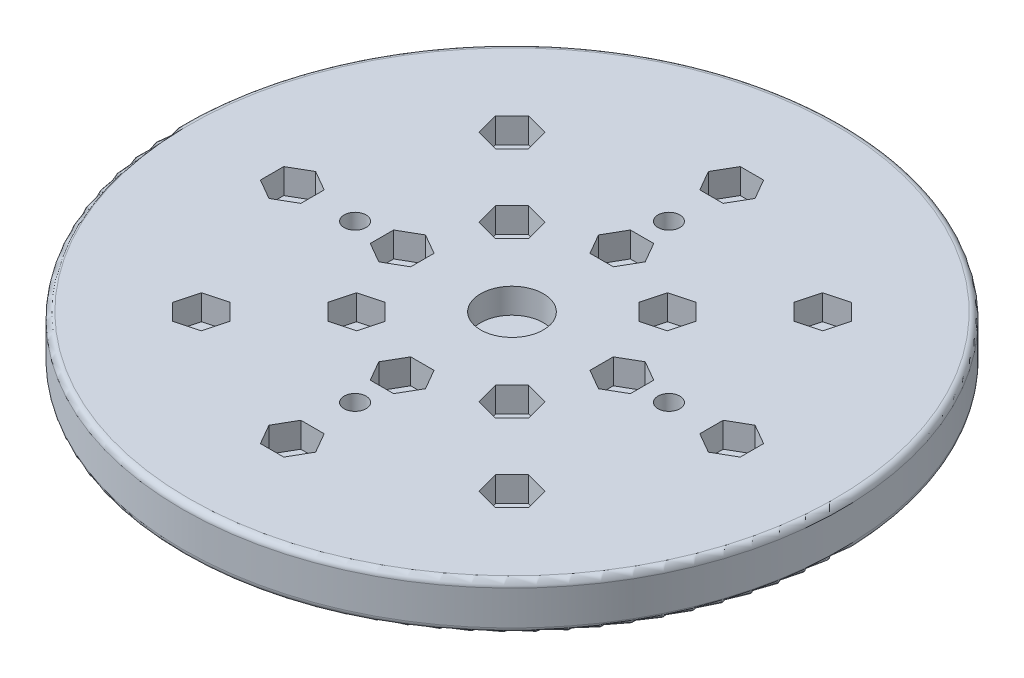
from build123d import *

# Parameters (mm, degrees)
SKETCH1_R                 = 105
BOSS_EXTRUDE1_DEPTH       = 7.5
SKETCH2_R                 = 3.5
CUT_EXTRUDE2_DEPTH        = 7.5
CIRPATTERN1_COUNT         = 2
CIRPATTERN1_ANGLE         = 90
FILLET2_R                 = 2
CUT_EXTRUDE3_DEPTH        = 8
LPATTERN1_COUNT           = 3
LPATTERN1_PITCH           = 35
CIRPATTERN2_COUNT         = 8
CIRPATTERN2_COPY_1_DEPTH  = 8
CIRPATTERN2_COPY_2_DEPTH  = 8
CIRPATTERN2_COPY_3_DEPTH  = 8
CIRPATTERN2_COPY_4_DEPTH  = 8
CIRPATTERN2_COPY_5_DEPTH  = 8
CIRPATTERN2_COPY_6_DEPTH  = 8
CIRPATTERN2_COPY_7_DEPTH  = 8
CIRPATTERN2_COPY_8_DEPTH  = 8
CIRPATTERN2_COPY_9_DEPTH  = 8
CIRPATTERN2_COPY_10_DEPTH = 8
CIRPATTERN2_COPY_11_DEPTH = 8
CIRPATTERN2_COPY_12_DEPTH = 8
CIRPATTERN2_COPY_13_DEPTH = 8
CIRPATTERN2_COPY_14_DEPTH = 8
SKETCH4_R                 = 10
CUT_EXTRUDE4_DEPTH        = 8


with BuildPart() as part:
    # Sketch1 → Boss-Extrude1 (new, symmetric)
    with BuildSketch(Plane(origin=(0, 0, 0), x_dir=(1, 0, 0), z_dir=(0, 1, 0))):
        with Locations(Location((0, 0, 0), (0, 0, 270))):
            Circle(SKETCH1_R)
    extrude(amount=BOSS_EXTRUDE1_DEPTH, both=True)

    # Sketch2 → Cut-Extrude2 (cut, symmetric)
    with BuildSketch(Plane(origin=(0, 0, 0), x_dir=(1, 0, 0), z_dir=(0, 1, 0))):
        with Locations(Location((0, 50, 0), (0, 0, 270))):
            Circle(SKETCH2_R)
        with Locations(Location((0, -50, 0), (0, 0, 270))):
            Circle(SKETCH2_R)
    cut_extrude2 = extrude(amount=CUT_EXTRUDE2_DEPTH, both=True, mode=Mode.SUBTRACT)

    # CirPattern1: Cut-Extrude2 ×2 about axis
    cirpattern1_axis = Axis((0, 0, 0), (0, 1, 0))
    for i in range(1, CIRPATTERN1_COUNT):
        add(cut_extrude2.rotate(cirpattern1_axis, i * CIRPATTERN1_ANGLE / (CIRPATTERN1_COUNT - 1)), mode=Mode.SUBTRACT)

    # Fillet2
    fillet2_edges = [part.edges().sort_by_distance(p)[0] for p in [
        (0, -7.5, -105),
        (0, 7.5, -105),
    ]]
    fillet(fillet2_edges, radius=FILLET2_R)

    # Sketch3 → Cut-Extrude3 (cut)
    with BuildSketch(Plane(origin=(0, 7.5, 0), x_dir=(1, 0, 0), z_dir=(0, 1, 0))):
        Polygon((3.718255526, 6.440207487), (-3.718255526, 6.440207487), (-7.436511052, 0), (-3.718255526, -6.440207487), (3.718255526, -6.440207487), (7.436511052, 0), align=None)
    cut_extrude3 = extrude(amount=-CUT_EXTRUDE3_DEPTH, mode=Mode.SUBTRACT)

    # LPattern1: Cut-Extrude3 ×3
    with Locations(*[(0, 0, i * LPATTERN1_PITCH) for i in range(1, LPATTERN1_COUNT)]):
        add(cut_extrude3, mode=Mode.SUBTRACT)

    # CirPattern2: Cut-Extrude3 ×8 about axis
    cirpattern2_axis = Axis((0, 0, 0), (0, 1, 0))
    for i in range(1, CIRPATTERN2_COUNT):
        add(cut_extrude3.rotate(cirpattern2_axis, i * 360 / CIRPATTERN2_COUNT), mode=Mode.SUBTRACT)

    # CirPattern2 copy 1 sketch → CirPattern2 copy 1 (cut)
    with BuildSketch(Plane(origin=(24.748737342, 7.5, 24.748737342), x_dir=(0.7071067811865476, 0, -0.7071067811865475), z_dir=(0, 1, 0))):
        Polygon((3.718255526, 6.440207487), (-3.718255526, 6.440207487), (-7.436511052, 0), (-3.718255526, -6.440207487), (3.718255526, -6.440207487), (7.436511052, 0), align=None)
    extrude(amount=-CIRPATTERN2_COPY_1_DEPTH, mode=Mode.SUBTRACT)

    # CirPattern2 copy 2 sketch → CirPattern2 copy 2 (cut)
    with BuildSketch(Plane(origin=(35, 7.5, 0), x_dir=(0, 0, -1), z_dir=(0, 1, 0))):
        Polygon((3.718255526, 6.440207487), (-3.718255526, 6.440207487), (-7.436511052, 0), (-3.718255526, -6.440207487), (3.718255526, -6.440207487), (7.436511052, 0), align=None)
    extrude(amount=-CIRPATTERN2_COPY_2_DEPTH, mode=Mode.SUBTRACT)

    # CirPattern2 copy 3 sketch → CirPattern2 copy 3 (cut)
    with BuildSketch(Plane(origin=(24.748737342, 7.5, -24.748737342), x_dir=(-0.7071067811865475, 0, -0.7071067811865476), z_dir=(0, 1, 0))):
        Polygon((3.718255526, 6.440207487), (-3.718255526, 6.440207487), (-7.436511052, 0), (-3.718255526, -6.440207487), (3.718255526, -6.440207487), (7.436511052, 0), align=None)
    extrude(amount=-CIRPATTERN2_COPY_3_DEPTH, mode=Mode.SUBTRACT)

    # CirPattern2 copy 4 sketch → CirPattern2 copy 4 (cut)
    with BuildSketch(Plane(origin=(0, 7.5, -35), x_dir=(-1, 0, 0), z_dir=(0, 1, 0))):
        Polygon((3.718255526, 6.440207487), (-3.718255526, 6.440207487), (-7.436511052, 0), (-3.718255526, -6.440207487), (3.718255526, -6.440207487), (7.436511052, 0), align=None)
    extrude(amount=-CIRPATTERN2_COPY_4_DEPTH, mode=Mode.SUBTRACT)

    # CirPattern2 copy 5 sketch → CirPattern2 copy 5 (cut)
    with BuildSketch(Plane(origin=(-24.748737342, 7.5, -24.748737342), x_dir=(-0.7071067811865477, 0, 0.7071067811865475), z_dir=(0, 1, 0))):
        Polygon((3.718255526, 6.440207487), (-3.718255526, 6.440207487), (-7.436511052, 0), (-3.718255526, -6.440207487), (3.718255526, -6.440207487), (7.436511052, 0), align=None)
    extrude(amount=-CIRPATTERN2_COPY_5_DEPTH, mode=Mode.SUBTRACT)

    # CirPattern2 copy 6 sketch → CirPattern2 copy 6 (cut)
    with BuildSketch(Plane(origin=(-35, 7.5, 0), x_dir=(0, 0, 1), z_dir=(0, 1, 0))):
        Polygon((3.718255526, 6.440207487), (-3.718255526, 6.440207487), (-7.436511052, 0), (-3.718255526, -6.440207487), (3.718255526, -6.440207487), (7.436511052, 0), align=None)
    extrude(amount=-CIRPATTERN2_COPY_6_DEPTH, mode=Mode.SUBTRACT)

    # CirPattern2 copy 7 sketch → CirPattern2 copy 7 (cut)
    with BuildSketch(Plane(origin=(-24.748737342, 7.5, 24.748737342), x_dir=(0.7071067811865474, 0, 0.7071067811865477), z_dir=(0, 1, 0))):
        Polygon((3.718255526, 6.440207487), (-3.718255526, 6.440207487), (-7.436511052, 0), (-3.718255526, -6.440207487), (3.718255526, -6.440207487), (7.436511052, 0), align=None)
    extrude(amount=-CIRPATTERN2_COPY_7_DEPTH, mode=Mode.SUBTRACT)

    # CirPattern2 copy 8 sketch → CirPattern2 copy 8 (cut)
    with BuildSketch(Plane(origin=(49.497474683, 7.5, 49.497474683), x_dir=(0.7071067811865476, 0, -0.7071067811865475), z_dir=(0, 1, 0))):
        Polygon((3.718255526, 6.440207487), (-3.718255526, 6.440207487), (-7.436511052, 0), (-3.718255526, -6.440207487), (3.718255526, -6.440207487), (7.436511052, 0), align=None)
    extrude(amount=-CIRPATTERN2_COPY_8_DEPTH, mode=Mode.SUBTRACT)

    # CirPattern2 copy 9 sketch → CirPattern2 copy 9 (cut)
    with BuildSketch(Plane(origin=(70, 7.5, 0), x_dir=(0, 0, -1), z_dir=(0, 1, 0))):
        Polygon((3.718255526, 6.440207487), (-3.718255526, 6.440207487), (-7.436511052, 0), (-3.718255526, -6.440207487), (3.718255526, -6.440207487), (7.436511052, 0), align=None)
    extrude(amount=-CIRPATTERN2_COPY_9_DEPTH, mode=Mode.SUBTRACT)

    # CirPattern2 copy 10 sketch → CirPattern2 copy 10 (cut)
    with BuildSketch(Plane(origin=(49.497474683, 7.5, -49.497474683), x_dir=(-0.7071067811865475, 0, -0.7071067811865476), z_dir=(0, 1, 0))):
        Polygon((3.718255526, 6.440207487), (-3.718255526, 6.440207487), (-7.436511052, 0), (-3.718255526, -6.440207487), (3.718255526, -6.440207487), (7.436511052, 0), align=None)
    extrude(amount=-CIRPATTERN2_COPY_10_DEPTH, mode=Mode.SUBTRACT)

    # CirPattern2 copy 11 sketch → CirPattern2 copy 11 (cut)
    with BuildSketch(Plane(origin=(0, 7.5, -70), x_dir=(-1, 0, 0), z_dir=(0, 1, 0))):
        Polygon((3.718255526, 6.440207487), (-3.718255526, 6.440207487), (-7.436511052, 0), (-3.718255526, -6.440207487), (3.718255526, -6.440207487), (7.436511052, 0), align=None)
    extrude(amount=-CIRPATTERN2_COPY_11_DEPTH, mode=Mode.SUBTRACT)

    # CirPattern2 copy 12 sketch → CirPattern2 copy 12 (cut)
    with BuildSketch(Plane(origin=(-49.497474683, 7.5, -49.497474683), x_dir=(-0.7071067811865477, 0, 0.7071067811865475), z_dir=(0, 1, 0))):
        Polygon((3.718255526, 6.440207487), (-3.718255526, 6.440207487), (-7.436511052, 0), (-3.718255526, -6.440207487), (3.718255526, -6.440207487), (7.436511052, 0), align=None)
    extrude(amount=-CIRPATTERN2_COPY_12_DEPTH, mode=Mode.SUBTRACT)

    # CirPattern2 copy 13 sketch → CirPattern2 copy 13 (cut)
    with BuildSketch(Plane(origin=(-70, 7.5, 0), x_dir=(0, 0, 1), z_dir=(0, 1, 0))):
        Polygon((3.718255526, 6.440207487), (-3.718255526, 6.440207487), (-7.436511052, 0), (-3.718255526, -6.440207487), (3.718255526, -6.440207487), (7.436511052, 0), align=None)
    extrude(amount=-CIRPATTERN2_COPY_13_DEPTH, mode=Mode.SUBTRACT)

    # CirPattern2 copy 14 sketch → CirPattern2 copy 14 (cut)
    with BuildSketch(Plane(origin=(-49.497474683, 7.5, 49.497474683), x_dir=(0.7071067811865474, 0, 0.7071067811865477), z_dir=(0, 1, 0))):
        Polygon((3.718255526, 6.440207487), (-3.718255526, 6.440207487), (-7.436511052, 0), (-3.718255526, -6.440207487), (3.718255526, -6.440207487), (7.436511052, 0), align=None)
    extrude(amount=-CIRPATTERN2_COPY_14_DEPTH, mode=Mode.SUBTRACT)

    # Sketch4 → Cut-Extrude4 (cut)
    with BuildSketch(Plane(origin=(0, 7.5, 0), x_dir=(1, 0, 0), z_dir=(0, 1, 0))):
        with Locations(Location((0, 0, 0), (0, 0, 270))):
            Circle(SKETCH4_R)
    extrude(amount=-CUT_EXTRUDE4_DEPTH, mode=Mode.SUBTRACT)


solid = part.part
